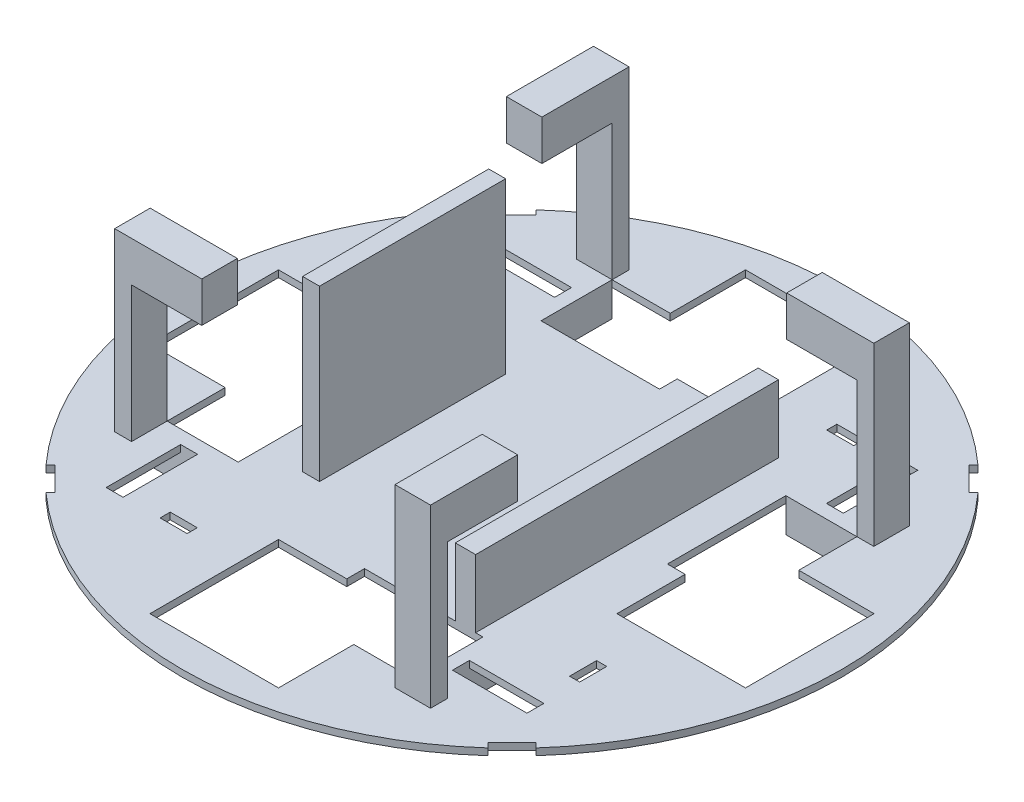
from build123d import *

# Parameters (mm, degrees)
SKETCH1_R                           = 97.5
PLATE_DEPTH                         = 2
SKETCH2_W                           = 38
SKETCH2_H                           = 38
FIN_CLEARANCES_DEPTH                = 2
SKETCH3_W                           = 17.168411885
SKETCH3_H                           = 21
SERVO_CLEARANCE_DEPTH               = 2
SKETCH4_W                           = 4
SKETCH4_H                           = 21
SERVO_LIP_BOTTOM_DEPTH              = 8
SKETCH5_W                           = 10.5
SKETCH5_H                           = 5
SERVO_LIP_TOP_EXTRUSION_DEPTH       = 52
SKETCH6_W                           = 10.5
SKETCH6_H                           = 11.9
SERVO_LIP_TOP_DEPTH                 = 20.75
SKETCH7_W                           = 35
SKETCH7_H                           = 21
SERVO_CLEARANCE_FOR_INSERTION_DEPTH = 2
F_4_SERVO_LIP_EXTRUSIONS_COUNT      = 4
SKETCH8_W                           = 10.5
SKETCH8_H                           = 11.9
BOSS_EXTRUDE6_DEPTH                 = 20.75
SKETCH9_W                           = 10.5
SKETCH9_H                           = 11.9
BOSS_EXTRUDE7_DEPTH                 = 20.75
SKETCH10_W                          = 10.5
SKETCH10_H                          = 11.9
BOSS_EXTRUDE8_DEPTH                 = 20.75
SKETCH11_W                          = 5
SKETCH11_H                          = 55
EBOX_LID_SUPPORT_DEPTH              = 50
CUT_EXTRUDE4_DEPTH                  = 2
CLIP_CLEARANCES_COUNT               = 4
SKETCH13_W                          = 6
SKETCH13_H                          = 89.5
EBOX_BOTTOM_SUPPORT_DEPTH           = 20
SKETCH14_W                          = 22
SKETCH14_H                          = 5
SKETCH14_W_2                        = 3
SKETCH14_H_2                        = 8
CUT_EXTRUDE5_DEPTH                  = 10
CIRPATTERN1_COUNT                   = 4


with BuildPart() as part:
    # Sketch1 → Plate (new body)
    with BuildSketch(Plane(origin=(0, 0, 0), x_dir=(1, 0, 0), z_dir=(0, 1, 0))):
        with Locations(Location((0, 0, 0), (0, 0, 270))):
            Circle(SKETCH1_R)
    extrude(amount=PLATE_DEPTH)

    # Sketch2 → Fin Clearances (cut)
    with BuildSketch(Plane(origin=(0, 2, 0), x_dir=(1, 0, 0), z_dir=(0, 1, 0))):
        with Locations((69, 0)):
            Rectangle(SKETCH2_W, SKETCH2_H)
        with Locations((0, 69)):
            Rectangle(SKETCH2_W, SKETCH2_H)
        with Locations((0, -69)):
            Rectangle(SKETCH2_W, SKETCH2_H)
        with Locations((-69, 0)):
            Rectangle(SKETCH2_W, SKETCH2_H)
    extrude(amount=-FIN_CLEARANCES_DEPTH, mode=Mode.SUBTRACT)

    # Sketch3 → Servo Clearance (cut)
    with BuildSketch(Plane.XZ):
        with Locations((-27.584205943, -55.25)):
            Rectangle(SKETCH3_W, SKETCH3_H)
    servo_clearance = extrude(amount=-SERVO_CLEARANCE_DEPTH, mode=Mode.SUBTRACT)

    # Sketch4 → Servo Lip - Bottom (add)
    with BuildSketch(Plane.XZ):
        with Locations((-38.168411885, -55.25)):
            Rectangle(SKETCH4_W, SKETCH4_H)
    servo_lip_bottom = extrude(amount=SERVO_LIP_BOTTOM_DEPTH)

    # Sketch5 → Servo Lip - Top Extrusion (add)
    with BuildSketch(Plane(origin=(0, 2, 0), x_dir=(1, 0, 0), z_dir=(0, 1, 0))):
        with Locations((-41.418411885, 68.25)):
            Rectangle(SKETCH5_W, SKETCH5_H)
    servo_lip_top_extrusion = extrude(amount=SERVO_LIP_TOP_EXTRUSION_DEPTH)

    # Sketch6 → Servo Lip - Top (add)
    with BuildSketch(Plane.XY.offset(-65.75)):
        with Locations((-41.418411885, 48.05)):
            Rectangle(SKETCH6_W, SKETCH6_H)
    extrude(amount=SERVO_LIP_TOP_DEPTH)

    # Sketch7 → Servo Clearance for Insertion (cut)
    with BuildSketch(Plane.XZ):
        with Locations((-18.668411885, -55.25)):
            Rectangle(SKETCH7_W, SKETCH7_H)
    servo_clearance_for_insertion = extrude(amount=-SERVO_CLEARANCE_FOR_INSERTION_DEPTH, mode=Mode.SUBTRACT)

    # 4 Servo Lip Extrusions: Servo Clearance, Servo Lip - Bottom, Servo Lip - Top Extrusion, Servo Clearance for Insertion ×4 about axis
    f_4_servo_lip_extrusions_axis = Axis((0, 0, 0), (0, 1, 0))
    add([servo_clearance.rotate(f_4_servo_lip_extrusions_axis, i * 360 / F_4_SERVO_LIP_EXTRUSIONS_COUNT) for i in range(1, F_4_SERVO_LIP_EXTRUSIONS_COUNT)], mode=Mode.SUBTRACT)
    add([servo_lip_bottom.rotate(f_4_servo_lip_extrusions_axis, i * 360 / F_4_SERVO_LIP_EXTRUSIONS_COUNT) for i in range(1, F_4_SERVO_LIP_EXTRUSIONS_COUNT)])
    add([servo_lip_top_extrusion.rotate(f_4_servo_lip_extrusions_axis, i * 360 / F_4_SERVO_LIP_EXTRUSIONS_COUNT) for i in range(1, F_4_SERVO_LIP_EXTRUSIONS_COUNT)])
    add([servo_clearance_for_insertion.rotate(f_4_servo_lip_extrusions_axis, i * 360 / F_4_SERVO_LIP_EXTRUSIONS_COUNT) for i in range(1, F_4_SERVO_LIP_EXTRUSIONS_COUNT)], mode=Mode.SUBTRACT)

    # Sketch8 → Boss-Extrude6 (add)
    with BuildSketch(Plane(origin=(-65.75, 0, 0), x_dir=(0, 0, -1), z_dir=(1, 0, 0))):
        with Locations((-41.418411885, 48.05)):
            Rectangle(SKETCH8_W, SKETCH8_H)
    extrude(amount=BOSS_EXTRUDE6_DEPTH)

    # Sketch9 → Boss-Extrude7 (add)
    with BuildSketch(Plane(origin=(0, 0, 65.75), x_dir=(-1, 0, 0), z_dir=(0, 0, -1))):
        with Locations((-41.418411885, 48.05)):
            Rectangle(SKETCH9_W, SKETCH9_H)
    extrude(amount=BOSS_EXTRUDE7_DEPTH)

    # Sketch10 → Boss-Extrude8 (add)
    with BuildSketch(Plane.ZY.offset(-65.75)):
        with Locations((-41.418411885, 48.05)):
            Rectangle(SKETCH10_W, SKETCH10_H)
    extrude(amount=BOSS_EXTRUDE8_DEPTH)

    # Sketch11 → EBox Lid Support (add)
    with BuildSketch(Plane(origin=(0, 2, 0), x_dir=(1, 0, 0), z_dir=(0, 1, 0))):
        with Locations((-30.25, -1.627343475)):
            Rectangle(SKETCH11_W, SKETCH11_H)
    extrude(amount=EBOX_LID_SUPPORT_DEPTH)

    # Sketch12 → Cut-Extrude4 (cut)
    with BuildSketch(Plane.XZ):
        Polygon((-71.064231509, 63.993163697), (-63.993163697, 71.064231509), (-65.40737726, 72.478445072), (-72.478445072, 65.40737726), align=None)
    cut_extrude4 = extrude(amount=-CUT_EXTRUDE4_DEPTH, mode=Mode.SUBTRACT)

    # Clip Clearances: Cut-Extrude4 ×4 about axis
    clip_clearances_axis = Axis((0, 0, 0), (0, 1, 0))
    for i in range(1, CLIP_CLEARANCES_COUNT):
        add(cut_extrude4.rotate(clip_clearances_axis, i * 360 / CLIP_CLEARANCES_COUNT), mode=Mode.SUBTRACT)

    # Sketch13 → EBox Bottom Support (add)
    with BuildSketch(Plane(origin=(0, 2, 0), x_dir=(1, 0, 0), z_dir=(0, 1, 0))):
        with Locations((31, 0)):
            Rectangle(SKETCH13_W, SKETCH13_H)
    extrude(amount=EBOX_BOTTOM_SUPPORT_DEPTH)

    # Sketch14 → Cut-Extrude5 (cut)
    with BuildSketch(Plane.XZ):
        with Locations((51.168411885, 55.25)):
            Rectangle(SKETCH14_W, SKETCH14_H)
        with Locations((60.5, 38)):
            Rectangle(SKETCH14_W_2, SKETCH14_H_2)
    cut_extrude5 = extrude(amount=-CUT_EXTRUDE5_DEPTH, mode=Mode.SUBTRACT)

    # CirPattern1: Cut-Extrude5 ×4 about axis
    cirpattern1_axis = Axis((0, 0, 0), (0, 1, 0))
    for i in range(1, CIRPATTERN1_COUNT):
        add(cut_extrude5.rotate(cirpattern1_axis, i * 360 / CIRPATTERN1_COUNT), mode=Mode.SUBTRACT)


solid = part.part
